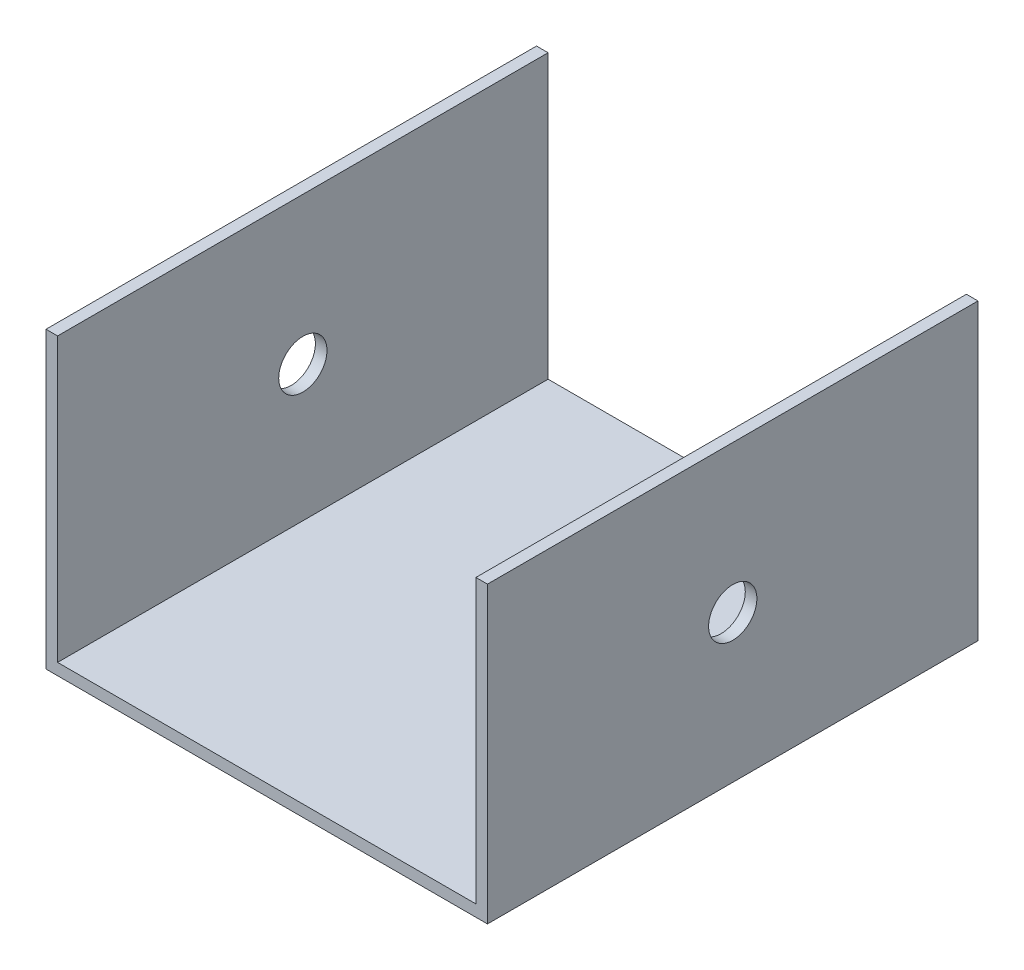
from build123d import *

# Parameters (mm, degrees)
BOSS_EXTRUDE1_DEPTH          = 127
F_12_5_12_5_DIAMETER_HOLE1_D = 12.5
F_12_5_12_5_DIAMETER_HOLE2_D = 12.5


with BuildPart() as part:
    # Sketch1 → Boss-Extrude1 (new body)
    with BuildSketch(Plane.XY):
        Polygon((54.15, -35.1), (54.15, 38.1), (57.15, 38.1), (57.15, -38.1), (-57.15, -38.1), (-57.15, 38.1), (-54.15, 38.1), (-54.15, -35.1), align=None)
    extrude(amount=BOSS_EXTRUDE1_DEPTH)

    # Ø12.5 (12.5) Diameter Hole1 (through all)
    with Locations(Plane(origin=(0, -35.1, 0), x_dir=(1, 0, 0), z_dir=(0, 1, 0))):
        with Locations((0, -63.5)):
            Hole(F_12_5_12_5_DIAMETER_HOLE1_D / 2)

    # Ø12.5 (12.5) Diameter Hole2 (through all)
    with Locations(Plane.ZY.offset(57.15)):
        with Locations((63.5, 0)):
            Hole(F_12_5_12_5_DIAMETER_HOLE2_D / 2)


solid = part.part
